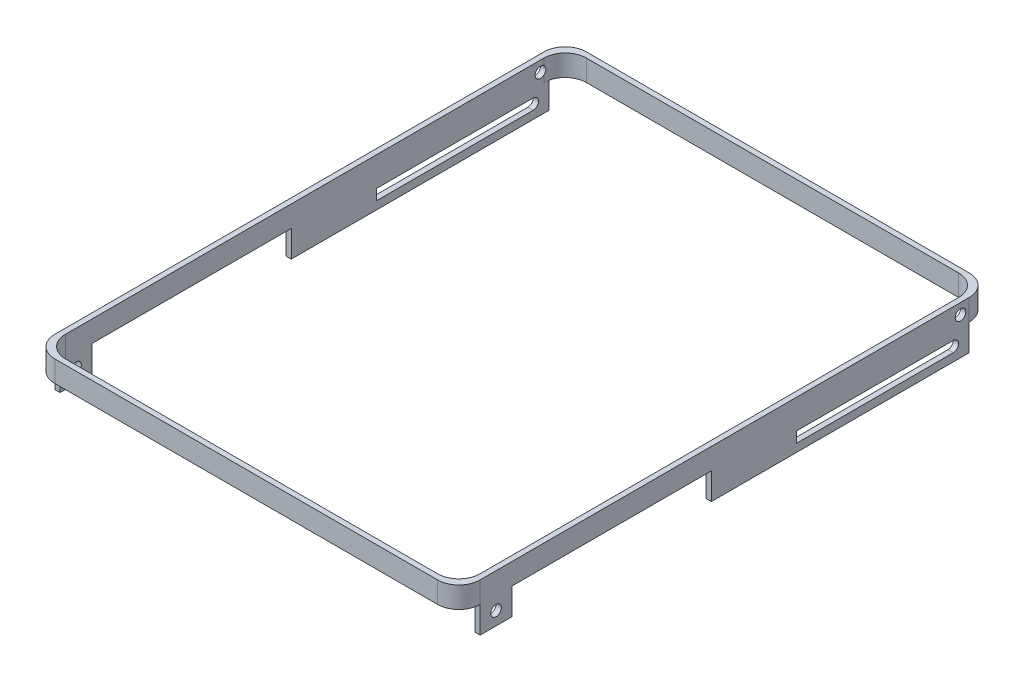
from build123d import *

# Parameters (mm, degrees)
BOSS_EXTRUDE2_DEPTH     = 20
CUT_EXTRUDE1_DEPTH      = 20
SKETCH7_W               = 242.556539121
SKETCH7_H               = 25
BOSS_EXTRUDE3_DEPTH     = 5
SKETCH8_W               = 242.556539121
SKETCH8_H               = 25
BOSS_EXTRUDE4_DEPTH     = 5
CUT_EXTRUDE2_DEPTH      = 473.361090692
CUT_EXTRUDE2_DEPTH_BACK = 473.361090692
SKETCH11_W              = 30
SKETCH11_H              = 25
BOSS_EXTRUDE5_DEPTH     = 5
SKETCH13_W              = 30
SKETCH13_H              = 25
BOSS_EXTRUDE6_DEPTH     = 5
SKETCH14_R              = 5
CUT_EXTRUDE3_DEPTH      = 473.361090692
BOSS_EXTRUDE7_DEPTH     = 5
BOSS_EXTRUDE8_START     = -5
BOSS_EXTRUDE8_DEPTH     = 5
SKETCH19_R              = 5
CUT_EXTRUDE4_DEPTH      = 473.361090692


with BuildPart() as part:
    # Sketch5 → Boss-Extrude2 (new body)
    with BuildSketch(Plane(origin=(0, 0, 0), x_dir=(1, 0, 0), z_dir=(0, 1, 0))):
        with BuildLine():
            Line((-180, 250), (180, 250))
            ThreePointArc((180, 250), (194.142135624, 244.142135624), (200, 230))
            Line((200, 230), (200, -230))
            ThreePointArc((200, -230), (194.142135624, -244.142135624), (180, -250))
            Line((180, -250), (-180, -250))
            ThreePointArc((-180, -250), (-194.142135624, -244.142135624), (-200, -230))
            Line((-200, -230), (-200, 230))
            ThreePointArc((-200, 230), (-194.142135624, 244.142135624), (-180, 250))
        make_face()
    extrude(amount=BOSS_EXTRUDE2_DEPTH)

    # Sketch6 → Cut-Extrude1 (cut)
    with BuildSketch(Plane(origin=(0, 20, 0), x_dir=(1, 0, 0), z_dir=(0, 1, 0))):
        with BuildLine():
            Line((-175, -245), (175, -245))
            ThreePointArc((175, -245), (189.142135624, -239.142135624), (195, -225))
            Line((195, -225), (195, 225))
            ThreePointArc((195, 225), (189.142135624, 239.142135624), (175, 245))
            Line((175, 245), (-175, 245))
            ThreePointArc((-175, 245), (-189.142135624, 239.142135624), (-195, 225))
            Line((-195, 225), (-195, -225))
            ThreePointArc((-195, -225), (-189.142135624, -239.142135624), (-175, -245))
        make_face()
    extrude(amount=-CUT_EXTRUDE1_DEPTH, mode=Mode.SUBTRACT)

    # Sketch7 → Boss-Extrude3 (add)
    with BuildSketch(Plane(origin=(200, 0, 0), x_dir=(0, 0, -1), z_dir=(1, 0, 0))):
        with Locations((108.72173044, -12.5)):
            Rectangle(SKETCH7_W, SKETCH7_H)
    extrude(amount=-BOSS_EXTRUDE3_DEPTH)

    # Sketch8 → Boss-Extrude4 (add)
    with BuildSketch(Plane.ZY.offset(200)):
        with Locations((-108.72173044, -12.5)):
            Rectangle(SKETCH8_W, SKETCH8_H)
    extrude(amount=-BOSS_EXTRUDE4_DEPTH)

    # Sketch10 → Cut-Extrude2 (cut, two sides: drawn at the far end of the back side and taken through both)
    with BuildSketch(Plane(origin=(200, 0, 0), x_dir=(0, 0, -1), z_dir=(1, 0, 0)).offset(-CUT_EXTRUDE2_DEPTH_BACK)):
        with BuildLine():
            Line((214.975112076, -7.5), (2.443460879, -7.5))
            ThreePointArc((2.443460879, -7.5), (-2.556539121, -12.5), (2.443460879, -17.5))
            Line((2.443460879, -17.5), (214.975112076, -17.5))
            ThreePointArc((214.975112076, -17.5), (219.975112076, -12.5), (214.975112076, -7.5))
        make_face()
    extrude(amount=CUT_EXTRUDE2_DEPTH + CUT_EXTRUDE2_DEPTH_BACK, mode=Mode.SUBTRACT)

    # Sketch11 → Boss-Extrude5 (add)
    with BuildSketch(Plane(origin=(200, 0, 0), x_dir=(0, 0, -1), z_dir=(1, 0, 0))):
        with Locations((-215, -12.5)):
            Rectangle(SKETCH11_W, SKETCH11_H)
    extrude(amount=-BOSS_EXTRUDE5_DEPTH)

    # Sketch13 → Boss-Extrude6 (add)
    with BuildSketch(Plane.ZY.offset(200)):
        with Locations((215, -12.5)):
            Rectangle(SKETCH13_W, SKETCH13_H)
    extrude(amount=-BOSS_EXTRUDE6_DEPTH)

    # Sketch14 → Cut-Extrude3 (cut, through all)
    with BuildSketch(Plane.ZY.offset(200)):
        with Locations((215, -12.5)):
            Circle(SKETCH14_R)
    extrude(amount=-CUT_EXTRUDE3_DEPTH, mode=Mode.SUBTRACT)

    # Sketch16 → Boss-Extrude7 (add)
    with BuildSketch(Plane.ZY.offset(200)):
        with BuildLine():
            Line((-67.443460879, -17.5), (-2.443460879, -17.5))
            ThreePointArc((-2.443460879, -17.5), (2.556539121, -12.5), (-2.443460879, -7.5))
            Line((-2.443460879, -7.5), (-67.443460879, -7.5))
            Line((-67.443460879, -7.5), (-67.443460879, -17.5))
        make_face()
    extrude(amount=-BOSS_EXTRUDE7_DEPTH)

    # Sketch17 → Boss-Extrude8 (add)
    with BuildSketch(Plane(origin=(200, 0, 0), x_dir=(0, 0, -1), z_dir=(1, 0, 0)).offset(BOSS_EXTRUDE8_START)):
        with BuildLine():
            Line((67.443460879, -17.5), (67.443460879, -7.5))
            Line((67.443460879, -7.5), (2.443460879, -7.5))
            ThreePointArc((2.443460879, -7.5), (-2.556539121, -12.5), (2.443460879, -17.5))
            Line((2.443460879, -17.5), (67.443460879, -17.5))
        make_face()
    extrude(amount=BOSS_EXTRUDE8_DEPTH)

    # Sketch19 → Cut-Extrude4 (cut, through all)
    with BuildSketch(Plane(origin=(200, 0, 0), x_dir=(0, 0, -1), z_dir=(1, 0, 0))):
        with Locations((221.779838072, 10)):
            Circle(SKETCH19_R)
    extrude(amount=-CUT_EXTRUDE4_DEPTH, mode=Mode.SUBTRACT)


solid = part.part
